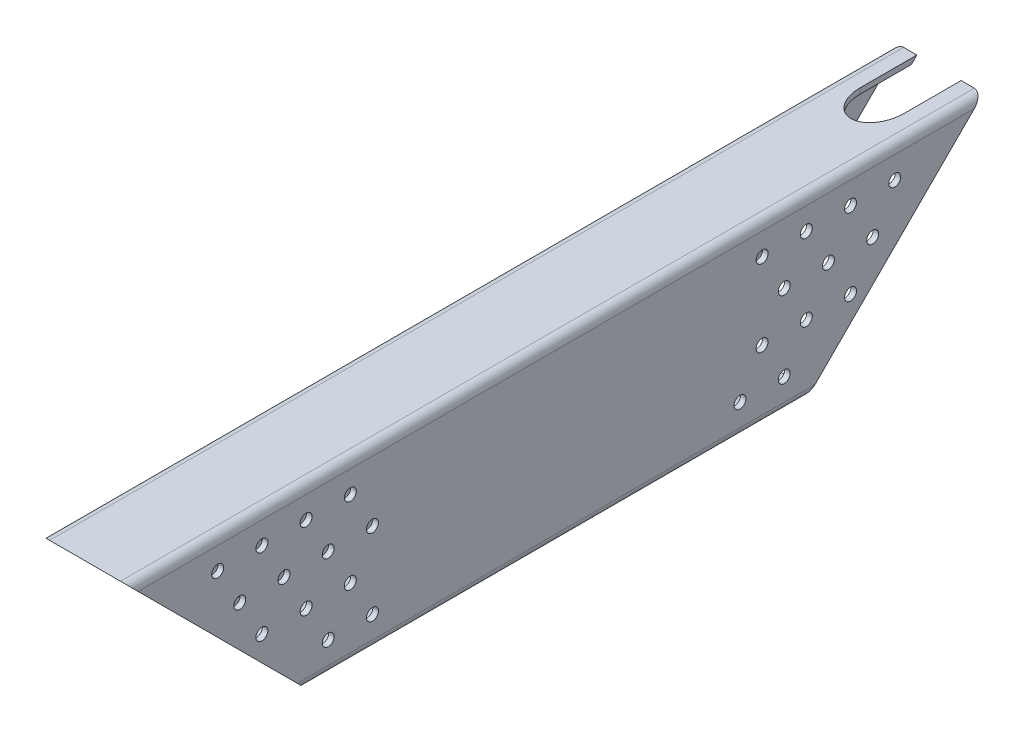
from build123d import *

# Parameters (mm, degrees)
EXTRUDE_THIN1_DEPTH          = 245.284098
CUT_EXTRUDE1_DEPTH           = 248.90040083
SKETCH4_R                    = 6.35
CUT_EXTRUDE2_DEPTH           = 237.025978745
CUT_EXTRUDE3_DEPTH           = 251.811121627
F_1_8_0_135_DIAMETER_HOLE1_D = 3.429


with BuildPart() as part:
    # Sketch1 → Extrude-Thin1 (new body)
    with BuildSketch(Plane.XY):
        with BuildLine():
            Line((-12.7, 22.86), (-12.7, -22.86))
            ThreePointArc((-12.7, -22.86), (-11.956051224, -24.656051224), (-10.16, -25.4))
            Line((-10.16, -25.4), (10.16, -25.4))
            ThreePointArc((10.16, -25.4), (11.956051224, -24.656051224), (12.7, -22.86))
            Line((12.7, -22.86), (12.7, 22.86))
            ThreePointArc((12.7, 22.86), (11.956051224, 24.656051224), (10.16, 25.4))
            Line((10.16, 25.4), (-10.16, 25.4))
            ThreePointArc((-10.16, 25.4), (-11.956051224, 24.656051224), (-12.7, 22.86))
        make_face()
        with BuildLine():
            Line((-11.1125, 22.86), (-11.1125, -22.86))
            ThreePointArc((-11.1125, -22.86), (-10.833519209, -23.533519209), (-10.16, -23.8125))
            Line((-10.16, -23.8125), (10.16, -23.8125))
            ThreePointArc((10.16, -23.8125), (10.833519209, -23.533519209), (11.1125, -22.86))
            Line((11.1125, -22.86), (11.1125, 22.86))
            ThreePointArc((11.1125, 22.86), (10.833519209, 23.533519209), (10.16, 23.8125))
            Line((10.16, 23.8125), (-10.16, 23.8125))
            ThreePointArc((-10.16, 23.8125), (-10.833519209, 23.533519209), (-11.1125, 22.86))
        make_face(mode=Mode.SUBTRACT)
    extrude(amount=EXTRUDE_THIN1_DEPTH)

    # Sketch2 → Cut-Extrude1 (cut, through all)
    with BuildSketch(Plane(origin=(12.7, 0, 0), x_dir=(0, 0, -1), z_dir=(1, 0, 0))):
        Polygon((-245.284097937, 25.4), (-194.484097937, -25.4), (-245.284097937, -25.4), align=None)
        Polygon((0, 25.4), (-50.8, -25.4), (0, -25.4), align=None)
    extrude(amount=-CUT_EXTRUDE1_DEPTH, mode=Mode.SUBTRACT)

    # Sketch4 → Cut-Extrude2 (cut, through all)
    with BuildSketch(Plane(origin=(0, 12.7, 12.7), x_dir=(1, 0, 0), z_dir=(0, -0.7071067811865476, -0.7071067811865476))):
        with Locations((0, -22.318463274)):
            Circle(SKETCH4_R)
        with Locations(Location((0, -6.443463274, 0), (0, 0, 270))):
            Circle(SKETCH4_R)
        with Locations((0, -38.193463274)):
            Circle(SKETCH4_R)
    extrude(amount=-CUT_EXTRUDE2_DEPTH, mode=Mode.SUBTRACT)

    # Sketch5 → Cut-Extrude3 (cut, through all)
    with BuildSketch(Plane(origin=(0, 25.4, 0), x_dir=(1, 0, 0), z_dir=(0, 1, 0))):
        with BuildLine():
            Line((-6.35, -16.28756685), (-6.35, 0))
            Line((-6.35, 0), (6.35, 0))
            Line((6.35, 0), (6.35, -16.28756685))
            add(Edge.make_bspline(
                [(-6.35, -16.28756685), (-6.35, -25.267822971), (0, -25.267822971), (6.35, -25.267822971), (6.35, -16.28756685)],
                knots=[1.570796327, 1.570796327, 1.570796327, 3.141592654, 3.141592654, 4.71238898, 4.71238898, 4.71238898], degree=2, weights=[1, 0.707106781, 1, 0.707106781, 1]))
        make_face()
    extrude(amount=-CUT_EXTRUDE3_DEPTH, mode=Mode.SUBTRACT)

    # 1/8 (0.135) Diameter Hole1 (through all)
    with Locations(Plane.ZY.offset(12.7)):
        with Locations((63.5, 16.497783942), (57.15, 5.499261314), (50.8, 16.497783942), (38.1, 16.497783942), (25.4, 16.497783942), (31.75, 5.499261314), (44.45, 5.499261314), (38.1, -5.499261314), (50.8, -5.499261314), (63.5, -5.499261314), (57.15, -16.497783942), (69.85, -16.497783942), (181.784097937, 16.497783942), (194.484097937, 16.497783942), (207.184097937, 16.497783942), (219.884097937, 16.497783942), (213.534097937, 5.499261314), (200.834097937, 5.499261314), (188.134097937, 5.499261314), (175.434097937, 5.499261314), (181.784097937, -5.499261314), (194.484097937, -5.499261314), (207.184097937, -5.499261314), (188.134097937, -16.497783942), (175.434097937, -16.497783942)):
            Hole(F_1_8_0_135_DIAMETER_HOLE1_D / 2)


solid = part.part
